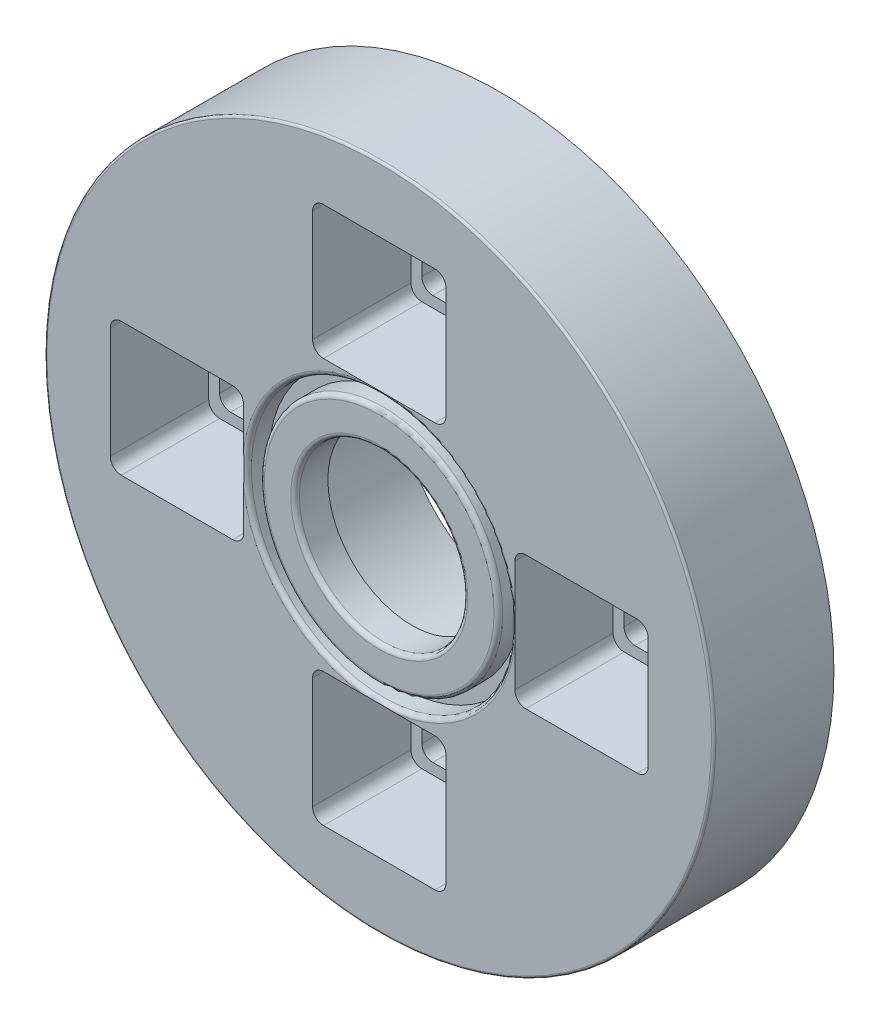
from build123d import *

# Parameters (mm, degrees)
IZIM1_R                     = 135
Y_KSEKLIK_EKSTR_ZYON1_DEPTH = 60
Y_KSEKLIK_EKSTR_ZYON2_START = 10
IZIM2_R                     = 153
Y_KSEKLIK_EKSTR_ZYON2_DEPTH = 50
IZIM3_R                     = 55
KES_EKSTR_ZYON1_DEPTH       = 741
Y_KSEKLIK_EKSTR_ZYON3_START = -50
IZIM4_R                     = 55
IZIM4_R_2                   = 38.5
Y_KSEKLIK_EKSTR_ZYON3_DEPTH = 10
IZIM5_R                     = 153
IZIM5_R_2                   = 38.5
Y_KSEKLIK_EKSTR_ZYON4_DEPTH = 5
IZIM6_R                     = 60.5
IZIM6_R_2                   = 54.5
KES_EKSTR_ZYON2_DEPTH       = 10
RADYUS2_R                   = 2
FILLET1_R                   = 1
CUT_EXTRUDE1_START          = -20
CUT_EXTRUDE1_DEPTH          = 206.926979422
CUT_EXTRUDE2_DEPTH          = 226.92697945


with BuildPart() as part:
    # Çizim1 → Yükseklik-Ekstrüzyon1 (new body)
    with BuildSketch(Plane.XY):
        Circle(IZIM1_R)
    extrude(amount=Y_KSEKLIK_EKSTR_ZYON1_DEPTH)

    # Çizim2 → Yükseklik-Ekstrüzyon2 (add)
    with BuildSketch(Plane.XY.offset(Y_KSEKLIK_EKSTR_ZYON2_START)):
        Circle(IZIM2_R)
    extrude(amount=Y_KSEKLIK_EKSTR_ZYON2_DEPTH)

    # Çizim3 → Kes-Ekstrüzyon1 (cut)
    with BuildSketch(Plane(origin=(0, 0, 0), x_dir=(-1, 0, 0), z_dir=(0, 0, -1))):
        Circle(IZIM3_R)
    extrude(amount=-KES_EKSTR_ZYON1_DEPTH, mode=Mode.SUBTRACT)

    # Çizim4 → Yükseklik-Ekstrüzyon3 (add)
    with BuildSketch(Plane(origin=(0, 0, 0), x_dir=(-1, 0, 0), z_dir=(0, 0, -1)).offset(Y_KSEKLIK_EKSTR_ZYON3_START)):
        Circle(IZIM4_R)
        Circle(IZIM4_R_2, mode=Mode.SUBTRACT)
    extrude(amount=-Y_KSEKLIK_EKSTR_ZYON3_DEPTH)

    # Çizim5 → Yükseklik-Ekstrüzyon4 (add)
    with BuildSketch(Plane.XY.offset(60)):
        Circle(IZIM5_R)
        with Locations(Location((0, 0, 0), (0, 0, 180))):
            Circle(IZIM5_R_2, mode=Mode.SUBTRACT)
    extrude(amount=Y_KSEKLIK_EKSTR_ZYON4_DEPTH)

    # Çizim6 → Kes-Ekstrüzyon2 (cut)
    with BuildSketch(Plane.XY.offset(65)):
        Circle(IZIM6_R)
        Circle(IZIM6_R_2, mode=Mode.SUBTRACT)
    extrude(amount=-KES_EKSTR_ZYON2_DEPTH, mode=Mode.SUBTRACT)

    # Radyus2
    radyus2_edges = [part.edges().sort_by_distance(p)[0] for p in [
        (38.5, 0, 65),
        (-60.5, 0, 65),
        (-54.5, 0, 65),
    ]]
    fillet(radyus2_edges, radius=RADYUS2_R)

    # Fillet1
    fillet1_edges = [part.edges().sort_by_distance(p)[0] for p in [
        (-153, 0, 65),
    ]]
    fillet(fillet1_edges, radius=FILLET1_R)

    # Sketch1 → Cut-Extrude1 (cut, through all)
    with BuildSketch(Plane(origin=(0, 0, 0), x_dir=(-1, 0, 0), z_dir=(0, 0, -1)).offset(CUT_EXTRUDE1_START)):
        with BuildLine():
            Line((25.5, 123), (-25.5, 123))
            ThreePointArc((-25.5, 123), (-29.035533906, 121.535533906), (-30.5, 118))
            Line((-30.5, 118), (-30.5, 67))
            ThreePointArc((-30.5, 67), (-29.035533906, 63.464466094), (-25.5, 62))
            Line((-25.5, 62), (25.5, 62))
            ThreePointArc((25.5, 62), (29.035533906, 63.464466094), (30.5, 67))
            Line((30.5, 67), (30.5, 118))
            ThreePointArc((30.5, 118), (29.035533906, 121.535533906), (25.5, 123))
        make_face()
        with BuildLine():
            Line((-118, 30.5), (-67, 30.5))
            ThreePointArc((-67, 30.5), (-63.464466094, 29.035533906), (-62, 25.5))
            Line((-62, 25.5), (-62, -25.5))
            ThreePointArc((-62, -25.5), (-63.464466094, -29.035533906), (-67, -30.5))
            Line((-67, -30.5), (-118, -30.5))
            ThreePointArc((-118, -30.5), (-121.535533906, -29.035533906), (-123, -25.5))
            Line((-123, -25.5), (-123, 25.5))
            ThreePointArc((-123, 25.5), (-121.535533906, 29.035533906), (-118, 30.5))
        make_face()
        with BuildLine():
            Line((123, -25.5), (123, 25.5))
            ThreePointArc((123, 25.5), (121.535533906, 29.035533906), (118, 30.5))
            Line((118, 30.5), (67, 30.5))
            ThreePointArc((67, 30.5), (63.464466094, 29.035533906), (62, 25.5))
            Line((62, 25.5), (62, -25.5))
            ThreePointArc((62, -25.5), (63.464466094, -29.035533906), (67, -30.5))
            Line((67, -30.5), (118, -30.5))
            ThreePointArc((118, -30.5), (121.535533906, -29.035533906), (123, -25.5))
        make_face()
        with BuildLine():
            Line((-25.5, -123), (25.5, -123))
            ThreePointArc((25.5, -123), (29.035533906, -121.535533906), (30.5, -118))
            Line((30.5, -118), (30.5, -67))
            ThreePointArc((30.5, -67), (29.035533906, -63.464466094), (25.5, -62))
            Line((25.5, -62), (-25.5, -62))
            ThreePointArc((-25.5, -62), (-29.035533906, -63.464466094), (-30.5, -67))
            Line((-30.5, -67), (-30.5, -118))
            ThreePointArc((-30.5, -118), (-29.035533906, -121.535533906), (-25.5, -123))
        make_face()
    extrude(amount=-CUT_EXTRUDE1_DEPTH, mode=Mode.SUBTRACT)

    # Sketch2 → Cut-Extrude2 (cut, through all)
    with BuildSketch(Plane(origin=(0, 0, 0), x_dir=(-1, 0, 0), z_dir=(0, 0, -1))):
        with BuildLine():
            Line((20.5, 118), (-20.5, 118))
            ThreePointArc((-20.5, 118), (-24.035533906, 116.535533906), (-25.5, 113))
            Line((-25.5, 113), (-25.5, 72))
            ThreePointArc((-25.5, 72), (-24.035533906, 68.464466094), (-20.5, 67))
            Line((-20.5, 67), (20.5, 67))
            ThreePointArc((20.5, 67), (24.035533906, 68.464466094), (25.5, 72))
            Line((25.5, 72), (25.5, 113))
            ThreePointArc((25.5, 113), (24.035533906, 116.535533906), (20.5, 118))
        make_face()
        with BuildLine():
            Line((-113, 25.5), (-72, 25.5))
            ThreePointArc((-72, 25.5), (-68.464466094, 24.035533906), (-67, 20.5))
            Line((-67, 20.5), (-67, -20.5))
            ThreePointArc((-67, -20.5), (-68.464466094, -24.035533906), (-72, -25.5))
            Line((-72, -25.5), (-113, -25.5))
            ThreePointArc((-113, -25.5), (-116.535533906, -24.035533906), (-118, -20.5))
            Line((-118, -20.5), (-118, 20.5))
            ThreePointArc((-118, 20.5), (-116.535533906, 24.035533906), (-113, 25.5))
        make_face()
        with BuildLine():
            Line((118, -20.5), (118, 20.5))
            ThreePointArc((118, 20.5), (116.535533906, 24.035533906), (113, 25.5))
            Line((113, 25.5), (72, 25.5))
            ThreePointArc((72, 25.5), (68.464466094, 24.035533906), (67, 20.5))
            Line((67, 20.5), (67, -20.5))
            ThreePointArc((67, -20.5), (68.464466094, -24.035533906), (72, -25.5))
            Line((72, -25.5), (113, -25.5))
            ThreePointArc((113, -25.5), (116.535533906, -24.035533906), (118, -20.5))
        make_face()
        with BuildLine():
            Line((-20.5, -118), (20.5, -118))
            ThreePointArc((20.5, -118), (24.035533906, -116.535533906), (25.5, -113))
            Line((25.5, -113), (25.5, -72))
            ThreePointArc((25.5, -72), (24.035533906, -68.464466094), (20.5, -67))
            Line((20.5, -67), (-20.5, -67))
            ThreePointArc((-20.5, -67), (-24.035533906, -68.464466094), (-25.5, -72))
            Line((-25.5, -72), (-25.5, -113))
            ThreePointArc((-25.5, -113), (-24.035533906, -116.535533906), (-20.5, -118))
        make_face()
    extrude(amount=-CUT_EXTRUDE2_DEPTH, mode=Mode.SUBTRACT)


solid = part.part
